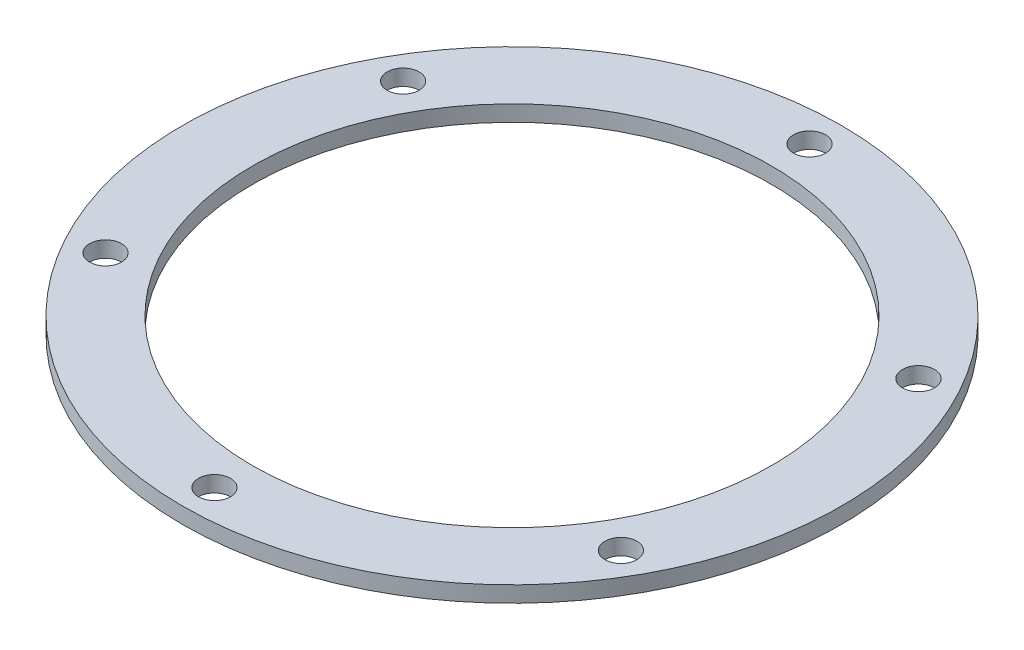
from build123d import *

# Parameters (mm, degrees)
SKETCH1_R           = 41.195
SKETCH1_R_2         = 32.445
SKETCH1_R_3         = 2
BOSS_EXTRUDE1_DEPTH = 2


with BuildPart() as part:
    # Sketch1 → Boss-Extrude1 (new body)
    with BuildSketch(Plane(origin=(0, 0, 0), x_dir=(1, 0, 0), z_dir=(0, 1, 0))):
        with Locations(Location((0, 0, 0), (0, 0, 270))):
            Circle(SKETCH1_R)
        with Locations(Location((0, 0, 0), (0, 0, 270))):
            Circle(SKETCH1_R_2, mode=Mode.SUBTRACT)
        with Locations(Location((0, 37.195, 0), (0, 0, 270))):
            Circle(SKETCH1_R_3, mode=Mode.SUBTRACT)
        with Locations(Location((32.211814894, 18.5975, 0), (0, 0, 270))):
            Circle(SKETCH1_R_3, mode=Mode.SUBTRACT)
        with Locations(Location((32.211814894, -18.5975, 0), (0, 0, 270))):
            Circle(SKETCH1_R_3, mode=Mode.SUBTRACT)
        with Locations(Location((0, -37.195, 0), (0, 0, 270))):
            Circle(SKETCH1_R_3, mode=Mode.SUBTRACT)
        with Locations(Location((-32.211814894, -18.5975, 0), (0, 0, 270))):
            Circle(SKETCH1_R_3, mode=Mode.SUBTRACT)
        with Locations(Location((-32.211814894, 18.5975, 0), (0, 0, 270))):
            Circle(SKETCH1_R_3, mode=Mode.SUBTRACT)
    extrude(amount=BOSS_EXTRUDE1_DEPTH)


solid = part.part
